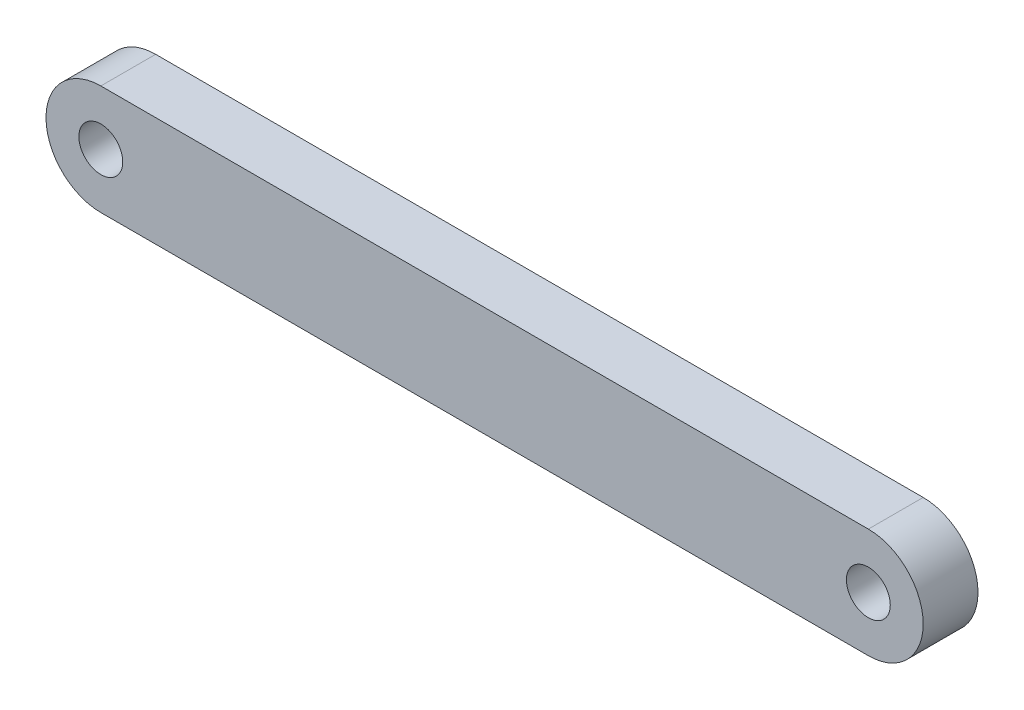
from build123d import *

# Parameters (mm, degrees)
BOSS_EXTRUDE1_DEPTH   = 5
F_8_0MM_DOWEL_HOLE1_D = 8


with BuildPart() as part:
    # Sketch1 → Boss-Extrude1 (new, symmetric)
    with BuildSketch(Plane.XY):
        with BuildLine():
            Line((-70, 10), (70, 10))
            ThreePointArc((70, 10), (80, 0), (70, -10))
            Line((70, -10), (-70, -10))
            ThreePointArc((-70, -10), (-80, 0), (-70, 10))
        make_face()
    extrude(amount=BOSS_EXTRUDE1_DEPTH, both=True)

    # Ø8.0mm Dowel Hole1 (through all)
    with Locations(Plane.XY.offset(5)):
        with Locations((-70, 0), (70, 0)):
            Hole(F_8_0MM_DOWEL_HOLE1_D / 2)


solid = part.part
